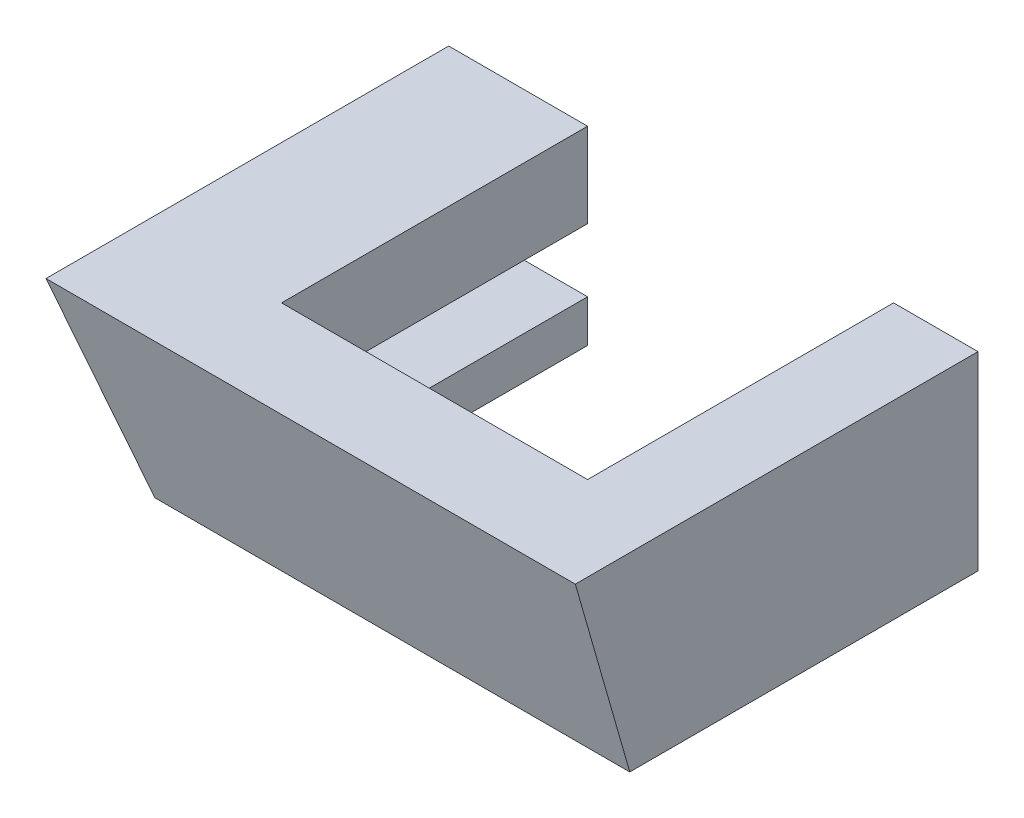
from build123d import *

# Parameters (mm, degrees)
SKETCH1_W           = 22.5
SKETCH1_H           = 16.5
BOSS_EXTRUDE1_DEPTH = 9
SKETCH3_W           = 14.5
SKETCH3_H           = 14.5
CUT_EXTRUDE2_DEPTH  = 74.330139174
DRAFT1_ANGLE        = 16
DRAFT3_ANGLE        = 16
SKETCH9_W           = 3
SKETCH9_H           = 3
CUT_EXTRUDE3_DEPTH  = 14.5


with BuildPart() as part:
    # Sketch1 → Boss-Extrude1 (new body)
    with BuildSketch(Plane(origin=(0, 0, 0), x_dir=(1, 0, 0), z_dir=(0, 1, 0))):
        with Locations((-33.839285714, -48.875)):
            Rectangle(SKETCH1_W, SKETCH1_H)
    extrude(amount=BOSS_EXTRUDE1_DEPTH)

    # Sketch3 → Cut-Extrude2 (cut, through all)
    with BuildSketch(Plane.XZ):
        with Locations((-33.839285714, 47.875)):
            Rectangle(SKETCH3_W, SKETCH3_H)
    extrude(amount=-CUT_EXTRUDE2_DEPTH, mode=Mode.SUBTRACT)

    # Draft1
    draft1_faces = [part.faces().sort_by_distance(p)[0] for p in [
        (-45.089285714, 4.5, 48.875),
    ]]
    draft(draft1_faces, Plane(origin=(0, 0, 0), x_dir=(0, 0, -1), z_dir=(0, -1, 0)), DRAFT1_ANGLE)

    # Draft3
    draft3_faces = [part.faces().sort_by_distance(p)[0] for p in [
        (-34.496127322, 4.58135782, 57.125),
    ]]
    draft(draft3_faces, Plane(origin=(0, 0, 0), x_dir=(0, 0, -1), z_dir=(0, -1, 0)), DRAFT3_ANGLE)

    # Sketch9 → Cut-Extrude3 (cut)
    with BuildSketch(Plane(origin=(0, 0, 40.625), x_dir=(-1, 0, 0), z_dir=(0, 0, 1))):
        with Locations((25.089285714, -3.5)):
            Rectangle(SKETCH9_W, SKETCH9_H)
        with Locations((42.589285714, -3.5)):
            Rectangle(SKETCH9_W, SKETCH9_H)
    extrude(amount=CUT_EXTRUDE3_DEPTH, mode=Mode.SUBTRACT)


solid = part.part
